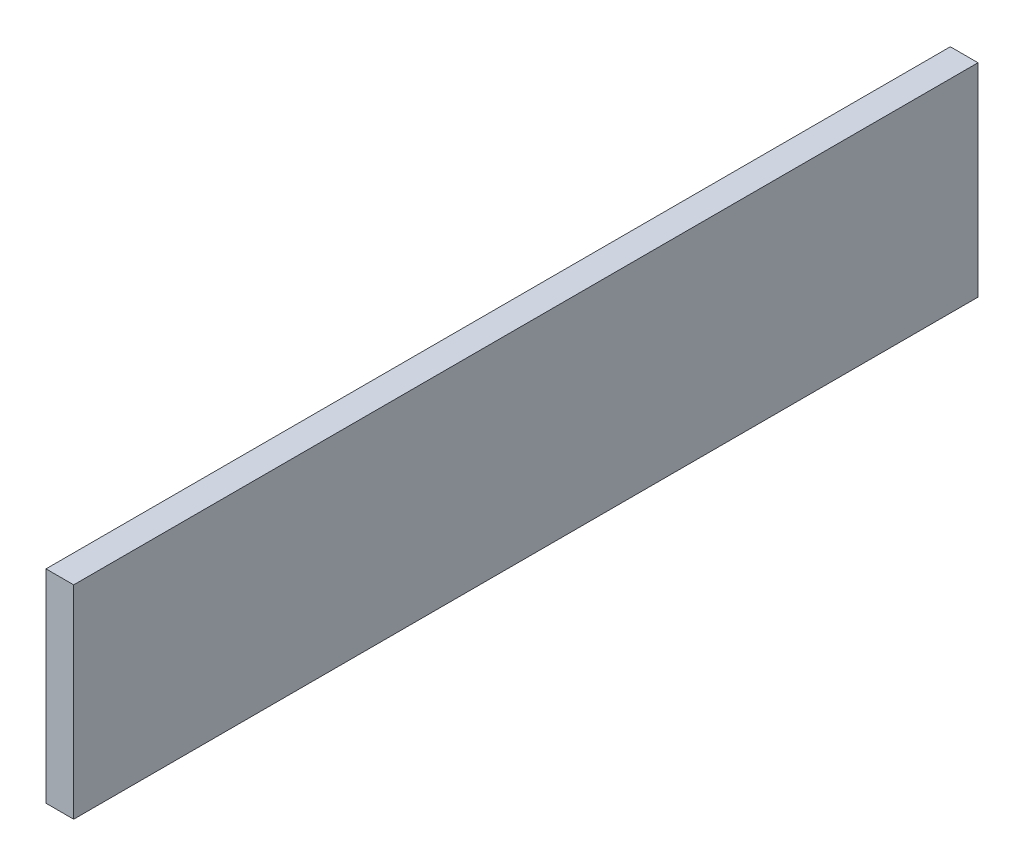
from build123d import *

# Parameters (mm, degrees)
SKETCH1_W           = 622.3
SKETCH1_H           = 139.7
BOSS_EXTRUDE1_DEPTH = 19.05


with BuildPart() as part:
    # Sketch1 → Boss-Extrude1 (new body)
    with BuildSketch(Plane(origin=(0, 0, 0), x_dir=(0, 0, -1), z_dir=(1, 0, 0))):
        with Locations((311.15, 69.85)):
            Rectangle(SKETCH1_W, SKETCH1_H)
    extrude(amount=BOSS_EXTRUDE1_DEPTH)


solid = part.part
